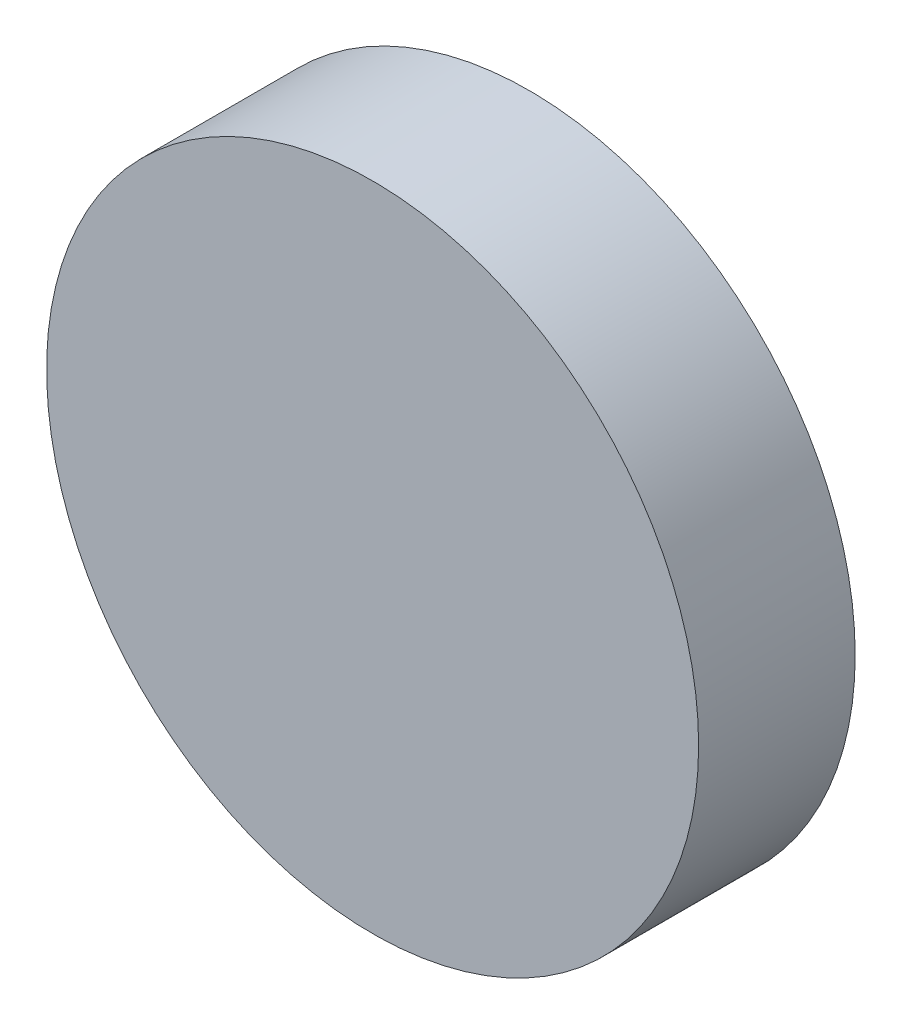
from build123d import *

# Parameters (mm, degrees)
ESBO_O1_R                = 17.075
RESSALTO_EXTRUS_O1_DEPTH = 8.2
ESBO_O2_R                = 8.85
CORTE_EXTRUS_O1_DEPTH    = 5


with BuildPart() as part:
    # Esboço1 → Ressalto-extrusão1 (new body)
    with BuildSketch(Plane.XY):
        Circle(ESBO_O1_R)
    extrude(amount=RESSALTO_EXTRUS_O1_DEPTH)

    # Esboço2 → Corte-extrusão1 (cut)
    with BuildSketch(Plane(origin=(0, 0, 0), x_dir=(-1, 0, 0), z_dir=(0, 0, -1))):
        Circle(ESBO_O2_R)
    extrude(amount=-CORTE_EXTRUS_O1_DEPTH, mode=Mode.SUBTRACT)


solid = part.part
